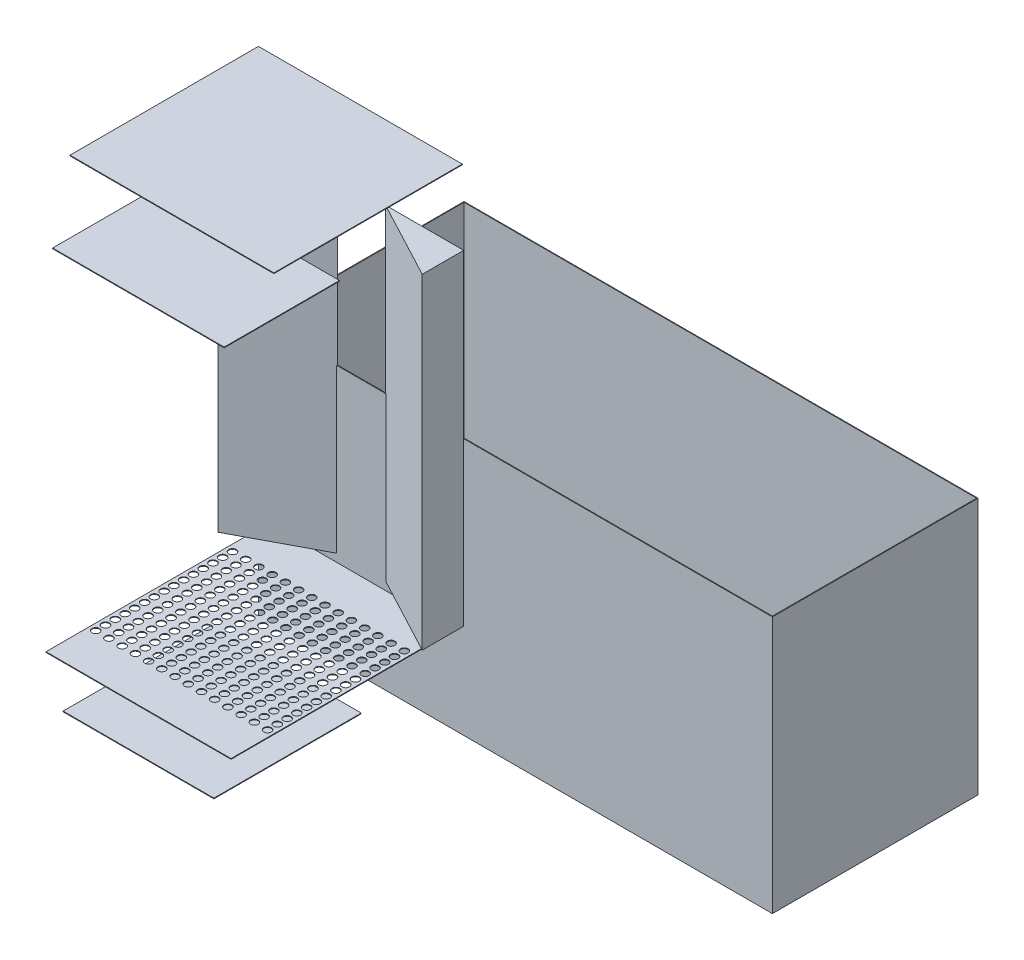
from build123d import *

# Parameters (mm, degrees)
MASTER_FOOTPRINT_W            = 1500
MASTER_FOOTPRINT_H            = 600
BATH_BASE_PLATE_DEPTH         = 750
BATH_SHELL_2MM_T              = -2
INLET_IMPACT_BAFFLE_START     = 125
SKETCH_1_W                    = 440
SKETCH_1_H                    = 430
INLET_IMPACT_BAFFLE_DEPTH     = 2
DISTRIBUTOR_D22_START         = 250
SKETCH_2_W                    = 540
SKETCH_2_H                    = 652
SKETCH_2_R                    = 11
DISTRIBUTOR_D22_DEPTH         = 2
OUTLET_SUBMERGED_BAFFLE_START = 1280
SKETCH_3_W                    = 500.714285714
SKETCH_3_H                    = 336.5
OUTLET_SUBMERGED_BAFFLE_DEPTH = 2
OVERFLOW_WEIR_Z550_START      = 1440
SKETCH_4_W                    = 595
SKETCH_4_H                    = 550
OVERFLOW_WEIR_Z550_DEPTH      = 2
SLOPED_SEDIMENT_FLOOR_START   = 275
SLOPED_SEDIMENT_FLOOR_DEPTH   = 950


with BuildPart() as part:
    # MASTER_FOOTPRINT → BATH_BASE_PLATE (new body)
    with BuildSketch(Plane(origin=(0, 0, 0), x_dir=(1, 0, 0), z_dir=(0, 1, 0))):
        with Locations((750, 300)):
            Rectangle(MASTER_FOOTPRINT_W, MASTER_FOOTPRINT_H)
    extrude(amount=BATH_BASE_PLATE_DEPTH)

    # BATH_SHELL_2MM
    bath_shell_2mm_openings = [part.faces().sort_by_distance(p)[0] for p in [
        (750, 750, -300),
    ]]
    offset(amount=BATH_SHELL_2MM_T, openings=bath_shell_2mm_openings, kind=Kind.INTERSECTION)

    # Эскиз5 → SLOPED_SEDIMENT_FLOOR (add)
    with BuildSketch(Plane(origin=(0, 0, 0), x_dir=(1, 0, 0), z_dir=(0, 1, 0)).offset(SLOPED_SEDIMENT_FLOOR_START)):
        Polygon((2, 1), (2, -120), (230, 1), align=None)
        Polygon((598, 1), (598, -120), (370, 1), align=None)
    extrude(amount=SLOPED_SEDIMENT_FLOOR_DEPTH)


with BuildPart() as body_2:
    # Эскиз1 → INLET_IMPACT_BAFFLE (new body)
    with BuildSketch(Plane(origin=(0, 0, 0), x_dir=(1, 0, 0), z_dir=(0, 1, 0)).offset(INLET_IMPACT_BAFFLE_START)):
        with Locations((300, -435)):
            Rectangle(SKETCH_1_W, SKETCH_1_H)
    extrude(amount=INLET_IMPACT_BAFFLE_DEPTH)


with BuildPart() as body_3:
    # Эскиз2 → DISTRIBUTOR_D22 (new body)
    with BuildSketch(Plane(origin=(0, 0, 0), x_dir=(1, 0, 0), z_dir=(0, 1, 0)).offset(DISTRIBUTOR_D22_START)):
        with Locations((300, -324)):
            Rectangle(SKETCH_2_W, SKETCH_2_H)
        with Locations(Location((49.285714286, -125, 0), (0, 0, 270))):
            Circle(SKETCH_2_R, mode=Mode.SUBTRACT)
        with Locations(Location((49.285714286, -153.5, 0), (0, 0, 270))):
            Circle(SKETCH_2_R, mode=Mode.SUBTRACT)
        with Locations(Location((49.285714286, -182, 0), (0, 0, 270))):
            Circle(SKETCH_2_R, mode=Mode.SUBTRACT)
        with Locations(Location((49.285714286, -210.5, 0), (0, 0, 270))):
            Circle(SKETCH_2_R, mode=Mode.SUBTRACT)
        with Locations(Location((49.285714286, -239, 0), (0, 0, 270))):
            Circle(SKETCH_2_R, mode=Mode.SUBTRACT)
        with Locations(Location((49.285714286, -267.5, 0), (0, 0, 270))):
            Circle(SKETCH_2_R, mode=Mode.SUBTRACT)
        with Locations(Location((49.285714286, -296, 0), (0, 0, 270))):
            Circle(SKETCH_2_R, mode=Mode.SUBTRACT)
        with Locations(Location((49.285714286, -324.5, 0), (0, 0, 270))):
            Circle(SKETCH_2_R, mode=Mode.SUBTRACT)
        with Locations(Location((49.285714286, -353, 0), (0, 0, 270))):
            Circle(SKETCH_2_R, mode=Mode.SUBTRACT)
        with Locations(Location((49.285714286, -381.5, 0), (0, 0, 270))):
            Circle(SKETCH_2_R, mode=Mode.SUBTRACT)
        with Locations(Location((49.285714286, -410, 0), (0, 0, 270))):
            Circle(SKETCH_2_R, mode=Mode.SUBTRACT)
        with Locations(Location((49.285714286, -438.5, 0), (0, 0, 270))):
            Circle(SKETCH_2_R, mode=Mode.SUBTRACT)
        with Locations(Location((49.285714286, -467, 0), (0, 0, 270))):
            Circle(SKETCH_2_R, mode=Mode.SUBTRACT)
        with Locations(Location((49.285714286, -495.5, 0), (0, 0, 270))):
            Circle(SKETCH_2_R, mode=Mode.SUBTRACT)
        with Locations(Location((49.285714286, -524, 0), (0, 0, 270))):
            Circle(SKETCH_2_R, mode=Mode.SUBTRACT)
        with Locations(Location((87.857142857, -125, 0), (0, 0, 270))):
            Circle(SKETCH_2_R, mode=Mode.SUBTRACT)
        with Locations(Location((87.857142857, -153.5, 0), (0, 0, 270))):
            Circle(SKETCH_2_R, mode=Mode.SUBTRACT)
        with Locations(Location((87.857142857, -182, 0), (0, 0, 270))):
            Circle(SKETCH_2_R, mode=Mode.SUBTRACT)
        with Locations(Location((87.857142857, -210.5, 0), (0, 0, 270))):
            Circle(SKETCH_2_R, mode=Mode.SUBTRACT)
        with Locations(Location((87.857142857, -239, 0), (0, 0, 270))):
            Circle(SKETCH_2_R, mode=Mode.SUBTRACT)
        with Locations(Location((87.857142857, -267.5, 0), (0, 0, 270))):
            Circle(SKETCH_2_R, mode=Mode.SUBTRACT)
        with Locations(Location((87.857142857, -296, 0), (0, 0, 270))):
            Circle(SKETCH_2_R, mode=Mode.SUBTRACT)
        with Locations(Location((87.857142857, -324.5, 0), (0, 0, 270))):
            Circle(SKETCH_2_R, mode=Mode.SUBTRACT)
        with Locations(Location((87.857142857, -353, 0), (0, 0, 270))):
            Circle(SKETCH_2_R, mode=Mode.SUBTRACT)
        with Locations(Location((87.857142857, -381.5, 0), (0, 0, 270))):
            Circle(SKETCH_2_R, mode=Mode.SUBTRACT)
        with Locations(Location((87.857142857, -410, 0), (0, 0, 270))):
            Circle(SKETCH_2_R, mode=Mode.SUBTRACT)
        with Locations(Location((87.857142857, -438.5, 0), (0, 0, 270))):
            Circle(SKETCH_2_R, mode=Mode.SUBTRACT)
        with Locations(Location((87.857142857, -467, 0), (0, 0, 270))):
            Circle(SKETCH_2_R, mode=Mode.SUBTRACT)
        with Locations(Location((87.857142857, -495.5, 0), (0, 0, 270))):
            Circle(SKETCH_2_R, mode=Mode.SUBTRACT)
        with Locations(Location((87.857142857, -524, 0), (0, 0, 270))):
            Circle(SKETCH_2_R, mode=Mode.SUBTRACT)
        with Locations(Location((126.428571429, -125, 0), (0, 0, 270))):
            Circle(SKETCH_2_R, mode=Mode.SUBTRACT)
        with Locations(Location((126.428571429, -153.5, 0), (0, 0, 270))):
            Circle(SKETCH_2_R, mode=Mode.SUBTRACT)
        with Locations(Location((126.428571429, -182, 0), (0, 0, 270))):
            Circle(SKETCH_2_R, mode=Mode.SUBTRACT)
        with Locations(Location((126.428571429, -210.5, 0), (0, 0, 270))):
            Circle(SKETCH_2_R, mode=Mode.SUBTRACT)
        with Locations(Location((126.428571429, -239, 0), (0, 0, 270))):
            Circle(SKETCH_2_R, mode=Mode.SUBTRACT)
        with Locations(Location((126.428571429, -267.5, 0), (0, 0, 270))):
            Circle(SKETCH_2_R, mode=Mode.SUBTRACT)
        with Locations(Location((126.428571429, -296, 0), (0, 0, 270))):
            Circle(SKETCH_2_R, mode=Mode.SUBTRACT)
        with Locations(Location((126.428571429, -324.5, 0), (0, 0, 270))):
            Circle(SKETCH_2_R, mode=Mode.SUBTRACT)
        with Locations(Location((126.428571429, -353, 0), (0, 0, 270))):
            Circle(SKETCH_2_R, mode=Mode.SUBTRACT)
        with Locations(Location((126.428571429, -381.5, 0), (0, 0, 270))):
            Circle(SKETCH_2_R, mode=Mode.SUBTRACT)
        with Locations(Location((126.428571429, -410, 0), (0, 0, 270))):
            Circle(SKETCH_2_R, mode=Mode.SUBTRACT)
        with Locations(Location((126.428571429, -438.5, 0), (0, 0, 270))):
            Circle(SKETCH_2_R, mode=Mode.SUBTRACT)
        with Locations(Location((126.428571429, -467, 0), (0, 0, 270))):
            Circle(SKETCH_2_R, mode=Mode.SUBTRACT)
        with Locations(Location((126.428571429, -495.5, 0), (0, 0, 270))):
            Circle(SKETCH_2_R, mode=Mode.SUBTRACT)
        with Locations(Location((126.428571429, -524, 0), (0, 0, 270))):
            Circle(SKETCH_2_R, mode=Mode.SUBTRACT)
        with Locations(Location((165, -125, 0), (0, 0, 270))):
            Circle(SKETCH_2_R, mode=Mode.SUBTRACT)
        with Locations(Location((165, -153.5, 0), (0, 0, 270))):
            Circle(SKETCH_2_R, mode=Mode.SUBTRACT)
        with Locations(Location((165, -182, 0), (0, 0, 270))):
            Circle(SKETCH_2_R, mode=Mode.SUBTRACT)
        with Locations(Location((165, -210.5, 0), (0, 0, 270))):
            Circle(SKETCH_2_R, mode=Mode.SUBTRACT)
        with Locations(Location((165, -239, 0), (0, 0, 270))):
            Circle(SKETCH_2_R, mode=Mode.SUBTRACT)
        with Locations(Location((165, -267.5, 0), (0, 0, 270))):
            Circle(SKETCH_2_R, mode=Mode.SUBTRACT)
        with Locations(Location((165, -296, 0), (0, 0, 270))):
            Circle(SKETCH_2_R, mode=Mode.SUBTRACT)
        with Locations(Location((165, -324.5, 0), (0, 0, 270))):
            Circle(SKETCH_2_R, mode=Mode.SUBTRACT)
        with Locations(Location((165, -353, 0), (0, 0, 270))):
            Circle(SKETCH_2_R, mode=Mode.SUBTRACT)
        with Locations(Location((165, -381.5, 0), (0, 0, 270))):
            Circle(SKETCH_2_R, mode=Mode.SUBTRACT)
        with Locations(Location((165, -410, 0), (0, 0, 270))):
            Circle(SKETCH_2_R, mode=Mode.SUBTRACT)
        with Locations(Location((165, -438.5, 0), (0, 0, 270))):
            Circle(SKETCH_2_R, mode=Mode.SUBTRACT)
        with Locations(Location((165, -467, 0), (0, 0, 270))):
            Circle(SKETCH_2_R, mode=Mode.SUBTRACT)
        with Locations(Location((165, -495.5, 0), (0, 0, 270))):
            Circle(SKETCH_2_R, mode=Mode.SUBTRACT)
        with Locations(Location((165, -524, 0), (0, 0, 270))):
            Circle(SKETCH_2_R, mode=Mode.SUBTRACT)
        with Locations(Location((203.571428571, -125, 0), (0, 0, 270))):
            Circle(SKETCH_2_R, mode=Mode.SUBTRACT)
        with Locations(Location((203.571428571, -153.5, 0), (0, 0, 270))):
            Circle(SKETCH_2_R, mode=Mode.SUBTRACT)
        with Locations(Location((203.571428571, -182, 0), (0, 0, 270))):
            Circle(SKETCH_2_R, mode=Mode.SUBTRACT)
        with Locations(Location((203.571428571, -210.5, 0), (0, 0, 270))):
            Circle(SKETCH_2_R, mode=Mode.SUBTRACT)
        with Locations(Location((203.571428571, -239, 0), (0, 0, 270))):
            Circle(SKETCH_2_R, mode=Mode.SUBTRACT)
        with Locations(Location((203.571428571, -267.5, 0), (0, 0, 270))):
            Circle(SKETCH_2_R, mode=Mode.SUBTRACT)
        with Locations(Location((203.571428571, -296, 0), (0, 0, 270))):
            Circle(SKETCH_2_R, mode=Mode.SUBTRACT)
        with Locations(Location((203.571428571, -324.5, 0), (0, 0, 270))):
            Circle(SKETCH_2_R, mode=Mode.SUBTRACT)
        with Locations(Location((203.571428571, -353, 0), (0, 0, 270))):
            Circle(SKETCH_2_R, mode=Mode.SUBTRACT)
        with Locations(Location((203.571428571, -381.5, 0), (0, 0, 270))):
            Circle(SKETCH_2_R, mode=Mode.SUBTRACT)
        with Locations(Location((203.571428571, -410, 0), (0, 0, 270))):
            Circle(SKETCH_2_R, mode=Mode.SUBTRACT)
        with Locations(Location((203.571428571, -438.5, 0), (0, 0, 270))):
            Circle(SKETCH_2_R, mode=Mode.SUBTRACT)
        with Locations(Location((203.571428571, -467, 0), (0, 0, 270))):
            Circle(SKETCH_2_R, mode=Mode.SUBTRACT)
        with Locations(Location((203.571428571, -495.5, 0), (0, 0, 270))):
            Circle(SKETCH_2_R, mode=Mode.SUBTRACT)
        with Locations(Location((203.571428571, -524, 0), (0, 0, 270))):
            Circle(SKETCH_2_R, mode=Mode.SUBTRACT)
        with Locations(Location((242.142857143, -125, 0), (0, 0, 270))):
            Circle(SKETCH_2_R, mode=Mode.SUBTRACT)
        with Locations(Location((242.142857143, -153.5, 0), (0, 0, 270))):
            Circle(SKETCH_2_R, mode=Mode.SUBTRACT)
        with Locations(Location((242.142857143, -182, 0), (0, 0, 270))):
            Circle(SKETCH_2_R, mode=Mode.SUBTRACT)
        with Locations(Location((242.142857143, -210.5, 0), (0, 0, 270))):
            Circle(SKETCH_2_R, mode=Mode.SUBTRACT)
        with Locations(Location((242.142857143, -239, 0), (0, 0, 270))):
            Circle(SKETCH_2_R, mode=Mode.SUBTRACT)
        with Locations(Location((242.142857143, -267.5, 0), (0, 0, 270))):
            Circle(SKETCH_2_R, mode=Mode.SUBTRACT)
        with Locations(Location((242.142857143, -296, 0), (0, 0, 270))):
            Circle(SKETCH_2_R, mode=Mode.SUBTRACT)
        with Locations(Location((242.142857143, -324.5, 0), (0, 0, 270))):
            Circle(SKETCH_2_R, mode=Mode.SUBTRACT)
        with Locations(Location((242.142857143, -353, 0), (0, 0, 270))):
            Circle(SKETCH_2_R, mode=Mode.SUBTRACT)
        with Locations(Location((242.142857143, -381.5, 0), (0, 0, 270))):
            Circle(SKETCH_2_R, mode=Mode.SUBTRACT)
        with Locations(Location((242.142857143, -410, 0), (0, 0, 270))):
            Circle(SKETCH_2_R, mode=Mode.SUBTRACT)
        with Locations(Location((242.142857143, -438.5, 0), (0, 0, 270))):
            Circle(SKETCH_2_R, mode=Mode.SUBTRACT)
        with Locations(Location((242.142857143, -467, 0), (0, 0, 270))):
            Circle(SKETCH_2_R, mode=Mode.SUBTRACT)
        with Locations(Location((242.142857143, -495.5, 0), (0, 0, 270))):
            Circle(SKETCH_2_R, mode=Mode.SUBTRACT)
        with Locations(Location((242.142857143, -524, 0), (0, 0, 270))):
            Circle(SKETCH_2_R, mode=Mode.SUBTRACT)
        with Locations(Location((280.714285714, -125, 0), (0, 0, 270))):
            Circle(SKETCH_2_R, mode=Mode.SUBTRACT)
        with Locations(Location((280.714285714, -153.5, 0), (0, 0, 270))):
            Circle(SKETCH_2_R, mode=Mode.SUBTRACT)
        with Locations(Location((280.714285714, -182, 0), (0, 0, 270))):
            Circle(SKETCH_2_R, mode=Mode.SUBTRACT)
        with Locations(Location((280.714285714, -210.5, 0), (0, 0, 270))):
            Circle(SKETCH_2_R, mode=Mode.SUBTRACT)
        with Locations(Location((280.714285714, -239, 0), (0, 0, 270))):
            Circle(SKETCH_2_R, mode=Mode.SUBTRACT)
        with Locations(Location((280.714285714, -267.5, 0), (0, 0, 270))):
            Circle(SKETCH_2_R, mode=Mode.SUBTRACT)
        with Locations(Location((280.714285714, -296, 0), (0, 0, 270))):
            Circle(SKETCH_2_R, mode=Mode.SUBTRACT)
        with Locations(Location((280.714285714, -324.5, 0), (0, 0, 270))):
            Circle(SKETCH_2_R, mode=Mode.SUBTRACT)
        with Locations(Location((280.714285714, -353, 0), (0, 0, 270))):
            Circle(SKETCH_2_R, mode=Mode.SUBTRACT)
        with Locations(Location((280.714285714, -381.5, 0), (0, 0, 270))):
            Circle(SKETCH_2_R, mode=Mode.SUBTRACT)
        with Locations(Location((280.714285714, -410, 0), (0, 0, 270))):
            Circle(SKETCH_2_R, mode=Mode.SUBTRACT)
        with Locations(Location((280.714285714, -438.5, 0), (0, 0, 270))):
            Circle(SKETCH_2_R, mode=Mode.SUBTRACT)
        with Locations(Location((280.714285714, -467, 0), (0, 0, 270))):
            Circle(SKETCH_2_R, mode=Mode.SUBTRACT)
        with Locations(Location((280.714285714, -495.5, 0), (0, 0, 270))):
            Circle(SKETCH_2_R, mode=Mode.SUBTRACT)
        with Locations(Location((280.714285714, -524, 0), (0, 0, 270))):
            Circle(SKETCH_2_R, mode=Mode.SUBTRACT)
        with Locations(Location((319.285714286, -125, 0), (0, 0, 270))):
            Circle(SKETCH_2_R, mode=Mode.SUBTRACT)
        with Locations(Location((319.285714286, -153.5, 0), (0, 0, 270))):
            Circle(SKETCH_2_R, mode=Mode.SUBTRACT)
        with Locations(Location((319.285714286, -182, 0), (0, 0, 270))):
            Circle(SKETCH_2_R, mode=Mode.SUBTRACT)
        with Locations(Location((319.285714286, -210.5, 0), (0, 0, 270))):
            Circle(SKETCH_2_R, mode=Mode.SUBTRACT)
        with Locations(Location((319.285714286, -239, 0), (0, 0, 270))):
            Circle(SKETCH_2_R, mode=Mode.SUBTRACT)
        with Locations(Location((319.285714286, -267.5, 0), (0, 0, 270))):
            Circle(SKETCH_2_R, mode=Mode.SUBTRACT)
        with Locations(Location((319.285714286, -296, 0), (0, 0, 270))):
            Circle(SKETCH_2_R, mode=Mode.SUBTRACT)
        with Locations(Location((319.285714286, -324.5, 0), (0, 0, 270))):
            Circle(SKETCH_2_R, mode=Mode.SUBTRACT)
        with Locations(Location((319.285714286, -353, 0), (0, 0, 270))):
            Circle(SKETCH_2_R, mode=Mode.SUBTRACT)
        with Locations(Location((319.285714286, -381.5, 0), (0, 0, 270))):
            Circle(SKETCH_2_R, mode=Mode.SUBTRACT)
        with Locations(Location((319.285714286, -410, 0), (0, 0, 270))):
            Circle(SKETCH_2_R, mode=Mode.SUBTRACT)
        with Locations(Location((319.285714286, -438.5, 0), (0, 0, 270))):
            Circle(SKETCH_2_R, mode=Mode.SUBTRACT)
        with Locations(Location((319.285714286, -467, 0), (0, 0, 270))):
            Circle(SKETCH_2_R, mode=Mode.SUBTRACT)
        with Locations(Location((319.285714286, -495.5, 0), (0, 0, 270))):
            Circle(SKETCH_2_R, mode=Mode.SUBTRACT)
        with Locations(Location((319.285714286, -524, 0), (0, 0, 270))):
            Circle(SKETCH_2_R, mode=Mode.SUBTRACT)
        with Locations(Location((357.857142857, -125, 0), (0, 0, 270))):
            Circle(SKETCH_2_R, mode=Mode.SUBTRACT)
        with Locations(Location((357.857142857, -153.5, 0), (0, 0, 270))):
            Circle(SKETCH_2_R, mode=Mode.SUBTRACT)
        with Locations(Location((357.857142857, -182, 0), (0, 0, 270))):
            Circle(SKETCH_2_R, mode=Mode.SUBTRACT)
        with Locations(Location((357.857142857, -210.5, 0), (0, 0, 270))):
            Circle(SKETCH_2_R, mode=Mode.SUBTRACT)
        with Locations(Location((357.857142857, -239, 0), (0, 0, 270))):
            Circle(SKETCH_2_R, mode=Mode.SUBTRACT)
        with Locations(Location((357.857142857, -267.5, 0), (0, 0, 270))):
            Circle(SKETCH_2_R, mode=Mode.SUBTRACT)
        with Locations(Location((357.857142857, -296, 0), (0, 0, 270))):
            Circle(SKETCH_2_R, mode=Mode.SUBTRACT)
        with Locations(Location((357.857142857, -324.5, 0), (0, 0, 270))):
            Circle(SKETCH_2_R, mode=Mode.SUBTRACT)
        with Locations(Location((357.857142857, -353, 0), (0, 0, 270))):
            Circle(SKETCH_2_R, mode=Mode.SUBTRACT)
        with Locations(Location((357.857142857, -381.5, 0), (0, 0, 270))):
            Circle(SKETCH_2_R, mode=Mode.SUBTRACT)
        with Locations(Location((357.857142857, -410, 0), (0, 0, 270))):
            Circle(SKETCH_2_R, mode=Mode.SUBTRACT)
        with Locations(Location((357.857142857, -438.5, 0), (0, 0, 270))):
            Circle(SKETCH_2_R, mode=Mode.SUBTRACT)
        with Locations(Location((357.857142857, -467, 0), (0, 0, 270))):
            Circle(SKETCH_2_R, mode=Mode.SUBTRACT)
        with Locations(Location((357.857142857, -495.5, 0), (0, 0, 270))):
            Circle(SKETCH_2_R, mode=Mode.SUBTRACT)
        with Locations(Location((357.857142857, -524, 0), (0, 0, 270))):
            Circle(SKETCH_2_R, mode=Mode.SUBTRACT)
        with Locations(Location((396.428571429, -125, 0), (0, 0, 270))):
            Circle(SKETCH_2_R, mode=Mode.SUBTRACT)
        with Locations(Location((396.428571429, -153.5, 0), (0, 0, 270))):
            Circle(SKETCH_2_R, mode=Mode.SUBTRACT)
        with Locations(Location((396.428571429, -182, 0), (0, 0, 270))):
            Circle(SKETCH_2_R, mode=Mode.SUBTRACT)
        with Locations(Location((396.428571429, -210.5, 0), (0, 0, 270))):
            Circle(SKETCH_2_R, mode=Mode.SUBTRACT)
        with Locations(Location((396.428571429, -239, 0), (0, 0, 270))):
            Circle(SKETCH_2_R, mode=Mode.SUBTRACT)
        with Locations(Location((396.428571429, -267.5, 0), (0, 0, 270))):
            Circle(SKETCH_2_R, mode=Mode.SUBTRACT)
        with Locations(Location((396.428571429, -296, 0), (0, 0, 270))):
            Circle(SKETCH_2_R, mode=Mode.SUBTRACT)
        with Locations(Location((396.428571429, -324.5, 0), (0, 0, 270))):
            Circle(SKETCH_2_R, mode=Mode.SUBTRACT)
        with Locations(Location((396.428571429, -353, 0), (0, 0, 270))):
            Circle(SKETCH_2_R, mode=Mode.SUBTRACT)
        with Locations(Location((396.428571429, -381.5, 0), (0, 0, 270))):
            Circle(SKETCH_2_R, mode=Mode.SUBTRACT)
        with Locations(Location((396.428571429, -410, 0), (0, 0, 270))):
            Circle(SKETCH_2_R, mode=Mode.SUBTRACT)
        with Locations(Location((396.428571429, -438.5, 0), (0, 0, 270))):
            Circle(SKETCH_2_R, mode=Mode.SUBTRACT)
        with Locations(Location((396.428571429, -467, 0), (0, 0, 270))):
            Circle(SKETCH_2_R, mode=Mode.SUBTRACT)
        with Locations(Location((396.428571429, -495.5, 0), (0, 0, 270))):
            Circle(SKETCH_2_R, mode=Mode.SUBTRACT)
        with Locations(Location((396.428571429, -524, 0), (0, 0, 270))):
            Circle(SKETCH_2_R, mode=Mode.SUBTRACT)
        with Locations(Location((435, -125, 0), (0, 0, 270))):
            Circle(SKETCH_2_R, mode=Mode.SUBTRACT)
        with Locations(Location((435, -153.5, 0), (0, 0, 270))):
            Circle(SKETCH_2_R, mode=Mode.SUBTRACT)
        with Locations(Location((435, -182, 0), (0, 0, 270))):
            Circle(SKETCH_2_R, mode=Mode.SUBTRACT)
        with Locations(Location((435, -210.5, 0), (0, 0, 270))):
            Circle(SKETCH_2_R, mode=Mode.SUBTRACT)
        with Locations(Location((435, -239, 0), (0, 0, 270))):
            Circle(SKETCH_2_R, mode=Mode.SUBTRACT)
        with Locations(Location((435, -267.5, 0), (0, 0, 270))):
            Circle(SKETCH_2_R, mode=Mode.SUBTRACT)
        with Locations(Location((435, -296, 0), (0, 0, 270))):
            Circle(SKETCH_2_R, mode=Mode.SUBTRACT)
        with Locations(Location((435, -324.5, 0), (0, 0, 270))):
            Circle(SKETCH_2_R, mode=Mode.SUBTRACT)
        with Locations(Location((435, -353, 0), (0, 0, 270))):
            Circle(SKETCH_2_R, mode=Mode.SUBTRACT)
        with Locations(Location((435, -381.5, 0), (0, 0, 270))):
            Circle(SKETCH_2_R, mode=Mode.SUBTRACT)
        with Locations(Location((435, -410, 0), (0, 0, 270))):
            Circle(SKETCH_2_R, mode=Mode.SUBTRACT)
        with Locations(Location((435, -438.5, 0), (0, 0, 270))):
            Circle(SKETCH_2_R, mode=Mode.SUBTRACT)
        with Locations(Location((435, -467, 0), (0, 0, 270))):
            Circle(SKETCH_2_R, mode=Mode.SUBTRACT)
        with Locations(Location((435, -495.5, 0), (0, 0, 270))):
            Circle(SKETCH_2_R, mode=Mode.SUBTRACT)
        with Locations(Location((435, -524, 0), (0, 0, 270))):
            Circle(SKETCH_2_R, mode=Mode.SUBTRACT)
        with Locations(Location((473.571428571, -125, 0), (0, 0, 270))):
            Circle(SKETCH_2_R, mode=Mode.SUBTRACT)
        with Locations(Location((473.571428571, -153.5, 0), (0, 0, 270))):
            Circle(SKETCH_2_R, mode=Mode.SUBTRACT)
        with Locations(Location((473.571428571, -182, 0), (0, 0, 270))):
            Circle(SKETCH_2_R, mode=Mode.SUBTRACT)
        with Locations(Location((473.571428571, -210.5, 0), (0, 0, 270))):
            Circle(SKETCH_2_R, mode=Mode.SUBTRACT)
        with Locations(Location((473.571428571, -239, 0), (0, 0, 270))):
            Circle(SKETCH_2_R, mode=Mode.SUBTRACT)
        with Locations(Location((473.571428571, -267.5, 0), (0, 0, 270))):
            Circle(SKETCH_2_R, mode=Mode.SUBTRACT)
        with Locations(Location((473.571428571, -296, 0), (0, 0, 270))):
            Circle(SKETCH_2_R, mode=Mode.SUBTRACT)
        with Locations(Location((473.571428571, -324.5, 0), (0, 0, 270))):
            Circle(SKETCH_2_R, mode=Mode.SUBTRACT)
        with Locations(Location((473.571428571, -353, 0), (0, 0, 270))):
            Circle(SKETCH_2_R, mode=Mode.SUBTRACT)
        with Locations(Location((473.571428571, -381.5, 0), (0, 0, 270))):
            Circle(SKETCH_2_R, mode=Mode.SUBTRACT)
        with Locations(Location((473.571428571, -410, 0), (0, 0, 270))):
            Circle(SKETCH_2_R, mode=Mode.SUBTRACT)
        with Locations(Location((473.571428571, -438.5, 0), (0, 0, 270))):
            Circle(SKETCH_2_R, mode=Mode.SUBTRACT)
        with Locations(Location((473.571428571, -467, 0), (0, 0, 270))):
            Circle(SKETCH_2_R, mode=Mode.SUBTRACT)
        with Locations(Location((473.571428571, -495.5, 0), (0, 0, 270))):
            Circle(SKETCH_2_R, mode=Mode.SUBTRACT)
        with Locations(Location((473.571428571, -524, 0), (0, 0, 270))):
            Circle(SKETCH_2_R, mode=Mode.SUBTRACT)
        with Locations(Location((512.142857143, -125, 0), (0, 0, 270))):
            Circle(SKETCH_2_R, mode=Mode.SUBTRACT)
        with Locations(Location((512.142857143, -153.5, 0), (0, 0, 270))):
            Circle(SKETCH_2_R, mode=Mode.SUBTRACT)
        with Locations(Location((512.142857143, -182, 0), (0, 0, 270))):
            Circle(SKETCH_2_R, mode=Mode.SUBTRACT)
        with Locations(Location((512.142857143, -210.5, 0), (0, 0, 270))):
            Circle(SKETCH_2_R, mode=Mode.SUBTRACT)
        with Locations(Location((512.142857143, -239, 0), (0, 0, 270))):
            Circle(SKETCH_2_R, mode=Mode.SUBTRACT)
        with Locations(Location((512.142857143, -267.5, 0), (0, 0, 270))):
            Circle(SKETCH_2_R, mode=Mode.SUBTRACT)
        with Locations(Location((512.142857143, -296, 0), (0, 0, 270))):
            Circle(SKETCH_2_R, mode=Mode.SUBTRACT)
        with Locations(Location((512.142857143, -324.5, 0), (0, 0, 270))):
            Circle(SKETCH_2_R, mode=Mode.SUBTRACT)
        with Locations(Location((512.142857143, -353, 0), (0, 0, 270))):
            Circle(SKETCH_2_R, mode=Mode.SUBTRACT)
        with Locations(Location((512.142857143, -381.5, 0), (0, 0, 270))):
            Circle(SKETCH_2_R, mode=Mode.SUBTRACT)
        with Locations(Location((512.142857143, -410, 0), (0, 0, 270))):
            Circle(SKETCH_2_R, mode=Mode.SUBTRACT)
        with Locations(Location((512.142857143, -438.5, 0), (0, 0, 270))):
            Circle(SKETCH_2_R, mode=Mode.SUBTRACT)
        with Locations(Location((512.142857143, -467, 0), (0, 0, 270))):
            Circle(SKETCH_2_R, mode=Mode.SUBTRACT)
        with Locations(Location((512.142857143, -495.5, 0), (0, 0, 270))):
            Circle(SKETCH_2_R, mode=Mode.SUBTRACT)
        with Locations(Location((512.142857143, -524, 0), (0, 0, 270))):
            Circle(SKETCH_2_R, mode=Mode.SUBTRACT)
        with Locations(Location((550.714285714, -125, 0), (0, 0, 270))):
            Circle(SKETCH_2_R, mode=Mode.SUBTRACT)
        with Locations(Location((550.714285714, -153.5, 0), (0, 0, 270))):
            Circle(SKETCH_2_R, mode=Mode.SUBTRACT)
        with Locations(Location((550.714285714, -182, 0), (0, 0, 270))):
            Circle(SKETCH_2_R, mode=Mode.SUBTRACT)
        with Locations(Location((550.714285714, -210.5, 0), (0, 0, 270))):
            Circle(SKETCH_2_R, mode=Mode.SUBTRACT)
        with Locations(Location((550.714285714, -239, 0), (0, 0, 270))):
            Circle(SKETCH_2_R, mode=Mode.SUBTRACT)
        with Locations(Location((550.714285714, -267.5, 0), (0, 0, 270))):
            Circle(SKETCH_2_R, mode=Mode.SUBTRACT)
        with Locations(Location((550.714285714, -296, 0), (0, 0, 270))):
            Circle(SKETCH_2_R, mode=Mode.SUBTRACT)
        with Locations(Location((550.714285714, -324.5, 0), (0, 0, 270))):
            Circle(SKETCH_2_R, mode=Mode.SUBTRACT)
        with Locations(Location((550.714285714, -353, 0), (0, 0, 270))):
            Circle(SKETCH_2_R, mode=Mode.SUBTRACT)
        with Locations(Location((550.714285714, -381.5, 0), (0, 0, 270))):
            Circle(SKETCH_2_R, mode=Mode.SUBTRACT)
        with Locations(Location((550.714285714, -410, 0), (0, 0, 270))):
            Circle(SKETCH_2_R, mode=Mode.SUBTRACT)
        with Locations(Location((550.714285714, -438.5, 0), (0, 0, 270))):
            Circle(SKETCH_2_R, mode=Mode.SUBTRACT)
        with Locations(Location((550.714285714, -467, 0), (0, 0, 270))):
            Circle(SKETCH_2_R, mode=Mode.SUBTRACT)
        with Locations(Location((550.714285714, -495.5, 0), (0, 0, 270))):
            Circle(SKETCH_2_R, mode=Mode.SUBTRACT)
        with Locations(Location((550.714285714, -524, 0), (0, 0, 270))):
            Circle(SKETCH_2_R, mode=Mode.SUBTRACT)
    extrude(amount=DISTRIBUTOR_D22_DEPTH)


with BuildPart() as body_4:
    # Эскиз3 → OUTLET_SUBMERGED_BAFFLE (new body)
    with BuildSketch(Plane(origin=(0, 0, 0), x_dir=(1, 0, 0), z_dir=(0, 1, 0)).offset(OUTLET_SUBMERGED_BAFFLE_START)):
        with Locations((299.642857143, -481.75)):
            Rectangle(SKETCH_3_W, SKETCH_3_H)
    extrude(amount=OUTLET_SUBMERGED_BAFFLE_DEPTH)


with BuildPart() as body_5:
    # Эскиз4 → OVERFLOW_WEIR_Z550 (new body)
    with BuildSketch(Plane(origin=(0, 0, 0), x_dir=(1, 0, 0), z_dir=(0, 1, 0)).offset(OVERFLOW_WEIR_Z550_START)):
        with Locations((297.5, -275)):
            Rectangle(SKETCH_4_W, SKETCH_4_H)
    extrude(amount=OVERFLOW_WEIR_Z550_DEPTH)


solid = Compound([part.part, body_2.part, body_3.part, body_4.part, body_5.part])
